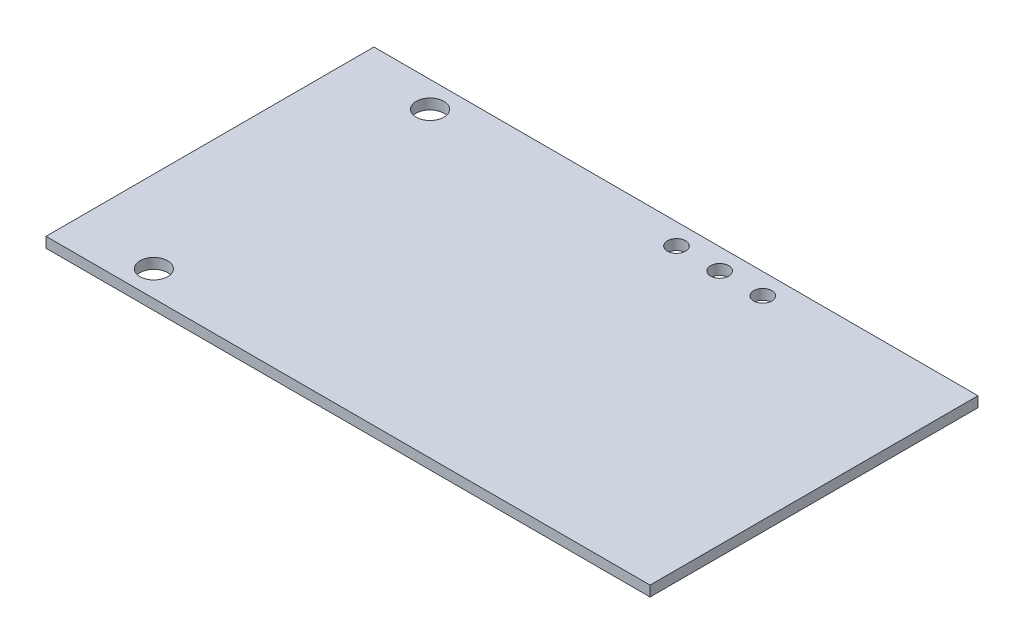
from build123d import *

# Parameters (mm, degrees)
SKETCH1_W           = 70
SKETCH1_H           = 38
BOSS_EXTRUDE1_DEPTH = 1.2
SKETCH2_R           = 1.6
SKETCH2_R_2         = 1.05
CUT_EXTRUDE1_DEPTH  = 40.842690672


with BuildPart() as part:
    # Sketch1 → Boss-Extrude1 (new body)
    with BuildSketch(Plane(origin=(0, 0, 0), x_dir=(1, 0, 0), z_dir=(0, 1, 0))):
        Rectangle(SKETCH1_W, SKETCH1_H)
    extrude(amount=BOSS_EXTRUDE1_DEPTH)

    # Sketch2 → Cut-Extrude1 (cut, through all)
    with BuildSketch(Plane(origin=(0, 1.2, 0), x_dir=(1, 0, 0), z_dir=(0, 1, 0))):
        with Locations(Location((-25.5, 16, 0), (0, 0, 270))):
            Circle(SKETCH2_R)
        with Locations(Location((-25.5, -16, 0), (0, 0, 270))):
            Circle(SKETCH2_R)
        with Locations(Location((2.5, 16.56, 0), (0, 0, 270))):
            Circle(SKETCH2_R_2)
        with Locations(Location((7.5, 16.56, 0), (0, 0, 270))):
            Circle(SKETCH2_R_2)
        with Locations(Location((12.5, 16.56, 0), (0, 0, 270))):
            Circle(SKETCH2_R_2)
    extrude(amount=-CUT_EXTRUDE1_DEPTH, mode=Mode.SUBTRACT)


solid = part.part
